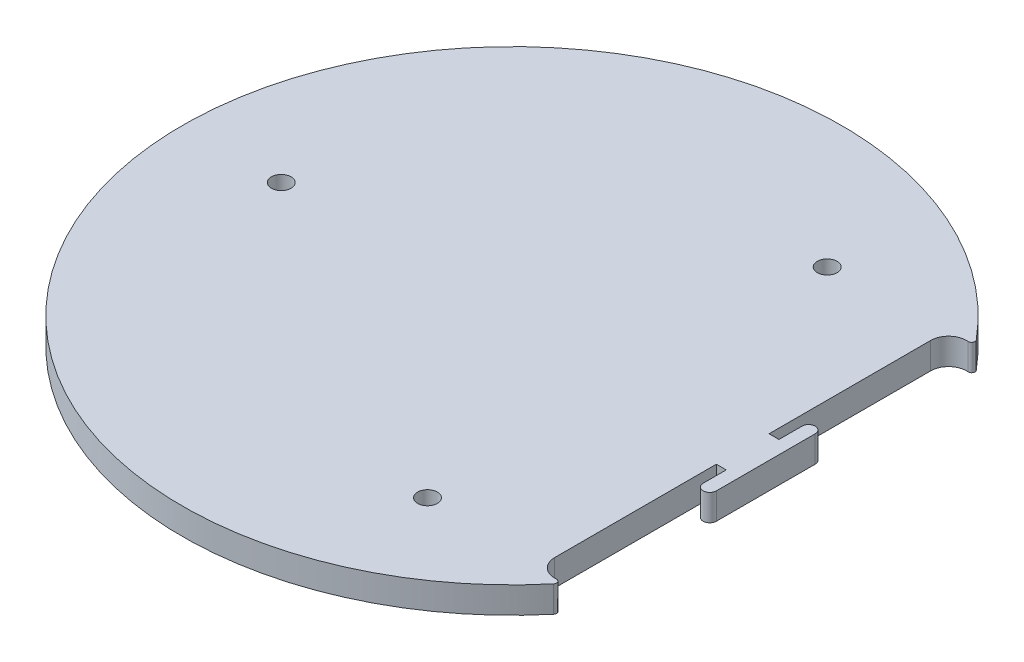
from build123d import *

# Parameters (mm, degrees)
SALIENTE_EXTRUIR1_DEPTH = 2
CROQUIS2_R              = 1.5
CORTAR_EXTRUIR1_DEPTH   = 7
CROQUIS3_R              = 4
CROQUIS3_R_2            = 3
SALIENTE_EXTRUIR2_DEPTH = 5


with BuildPart() as part:
    # Croquis1 → Saliente-Extruir1 (new, symmetric)
    with BuildSketch(Plane(origin=(0, 0, 0), x_dir=(1, 0, 0), z_dir=(0, 1, 0))):
        with BuildLine():
            Line((35, -28.516113802), (35, -4))
            Line((35, -4), (36.5, -4))
            Line((36.5, -4), (36.5, -7.5))
            ThreePointArc((36.5, -7.5), (37.5, -8.5), (38.5, -7.5))
            Line((38.5, -7.5), (38.5, 7.5))
            ThreePointArc((38.5, 7.5), (37.5, 8.5), (36.5, 7.5))
            Line((36.5, 7.5), (36.5, 4))
            Line((36.5, 4), (35, 4))
            Line((35, 4), (35, 28.516113802))
            ThreePointArc((35, 28.516113802), (35.879823326, 30.517678888), (37.949409202, 31.222779006))
            ThreePointArc((37.949409202, 31.222779006), (38.439227262, 31.49182987), (38.37918033, 32.047441664))
            ThreePointArc((38.37918033, 32.047441664), (-50, 0), (38.37918033, -32.047441664))
            ThreePointArc((38.37918033, -32.047441664), (38.439227262, -31.49182987), (37.949409202, -31.222779006))
            ThreePointArc((37.949409202, -31.222779006), (35.879823326, -30.517678888), (35, -28.516113802))
        make_face()
    extrude(amount=SALIENTE_EXTRUIR1_DEPTH, both=True)

    # Croquis2 → Cortar-Extruir1 (cut)
    with BuildSketch(Plane.XZ.offset(2)):
        with Locations(Location((17.5, 30.310889132, 0), (0, 0, 270))):
            Circle(CROQUIS2_R)
        with Locations(Location((-35, 0, 0), (0, 0, 270))):
            Circle(CROQUIS2_R)
        with Locations(Location((17.5, -30.310889132, 0), (0, 0, 270))):
            Circle(CROQUIS2_R)
    extrude(amount=-CORTAR_EXTRUIR1_DEPTH, mode=Mode.SUBTRACT)

    # Croquis3 → Saliente-Extruir2 (add)
    # profile 1 of 3: a face of its own
    with BuildSketch(Plane.XZ.offset(2)):
        with Locations(Location((-35, 0, 0), (0, 0, 90))):
            Circle(CROQUIS3_R)
        with Locations(Location((-35, 0, 0), (0, 0, 270))):
            Circle(CROQUIS3_R_2, mode=Mode.SUBTRACT)
    # profile 2 of 3: a face of its own
    with BuildSketch(Plane.XZ.offset(2)):
        with Locations(Location((17.5, 30.310889132, 0), (0, 0, 90))):
            Circle(CROQUIS3_R)
        with Locations(Location((17.5, 30.310889132, 0), (0, 0, 270))):
            Circle(CROQUIS3_R_2, mode=Mode.SUBTRACT)
    # profile 3 of 3: a face of its own
    with BuildSketch(Plane.XZ.offset(2)):
        with Locations(Location((17.5, -30.310889132, 0), (0, 0, 90))):
            Circle(CROQUIS3_R)
        with Locations(Location((17.5, -30.310889132, 0), (0, 0, 270))):
            Circle(CROQUIS3_R_2, mode=Mode.SUBTRACT)
    extrude(amount=SALIENTE_EXTRUIR2_DEPTH)


solid = part.part
